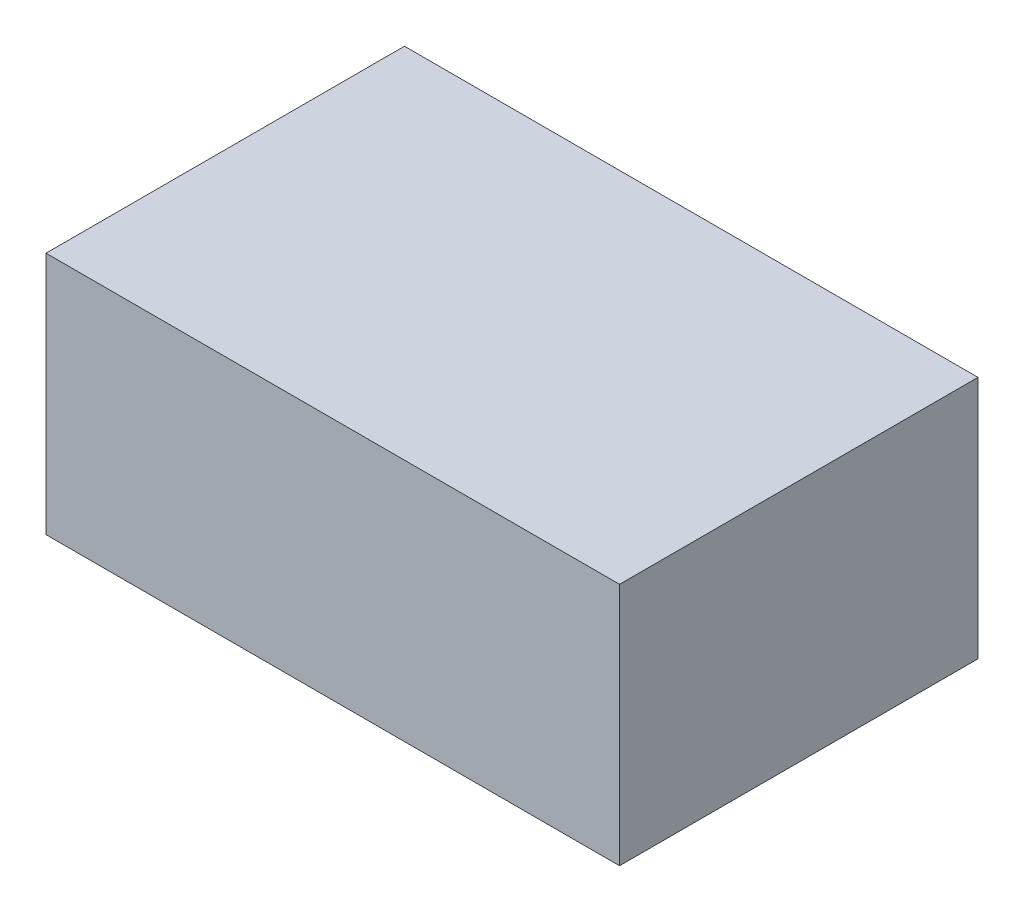
from build123d import *

# Parameters (mm, degrees)
SKETCH1_W           = 2
SKETCH1_H           = 1.25
BOSS_EXTRUDE1_DEPTH = 0.85


with BuildPart() as part:
    # Sketch1 → Boss-Extrude1 (new body)
    with BuildSketch(Plane(origin=(0, 0, 0), x_dir=(1, 0, 0), z_dir=(0, 1, 0))):
        with Locations((1, 0.625)):
            Rectangle(SKETCH1_W, SKETCH1_H)
    extrude(amount=BOSS_EXTRUDE1_DEPTH)


solid = part.part
